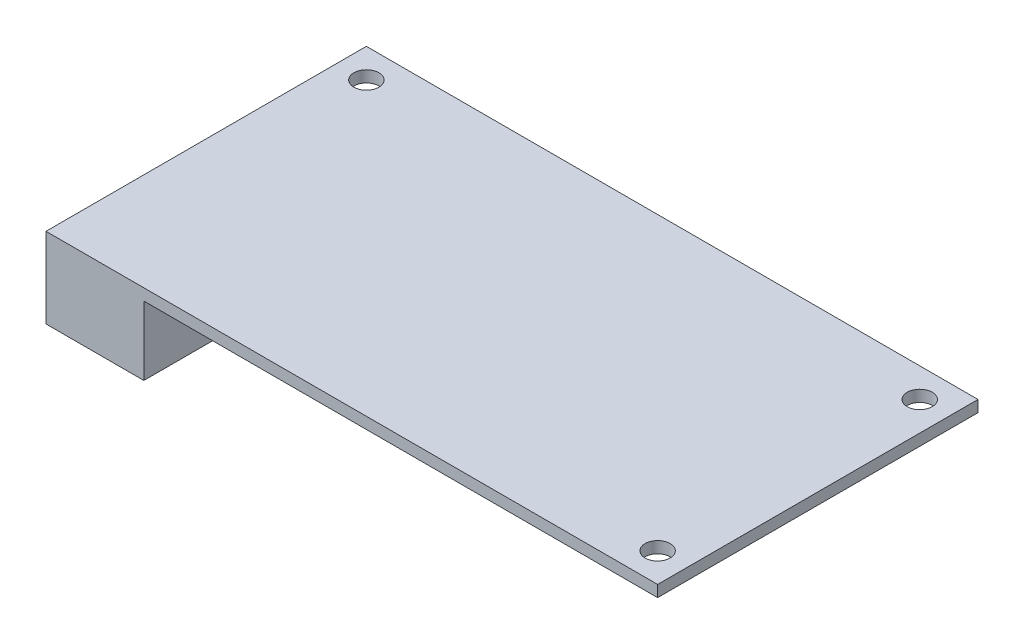
from build123d import *

# Parameters (mm, degrees)
SKETCH1_W           = 53.34
SKETCH1_H           = 27.94
SKETCH1_R           = 1.0922
BOSS_EXTRUDE1_DEPTH = 1
SKETCH2_W           = 8.533603159
SKETCH2_H           = 19.883520928
SKETCH2_W_2         = 10.243705623
SKETCH2_H_2         = 7.528700328
BOSS_EXTRUDE2_DEPTH = 7


with BuildPart() as part:
    # Sketch1 → Boss-Extrude1 (new body)
    with BuildSketch(Plane(origin=(0, 0, 0), x_dir=(1, 0, 0), z_dir=(0, 1, 0))):
        Rectangle(SKETCH1_W, SKETCH1_H)
        with Locations(Location((-24.13, 11.43, 0), (0, 0, 270))):
            Circle(SKETCH1_R, mode=Mode.SUBTRACT)
        with Locations(Location((24.13, 11.43, 0), (0, 0, 270))):
            Circle(SKETCH1_R, mode=Mode.SUBTRACT)
        with Locations(Location((24.13, -11.43, 0), (0, 0, 270))):
            Circle(SKETCH1_R, mode=Mode.SUBTRACT)
    extrude(amount=BOSS_EXTRUDE1_DEPTH)

    # Sketch2 → Boss-Extrude2 (add)
    with BuildSketch(Plane(origin=(0, 1, 0), x_dir=(1, 0, 0), z_dir=(0, 1, 0))):
        with Locations((-22.403198421, -4.028239536)):
            Rectangle(SKETCH2_W, SKETCH2_H)
        with Locations((-0.059974857, 10.205649836)):
            Rectangle(SKETCH2_W_2, SKETCH2_H_2)
    extrude(amount=-BOSS_EXTRUDE2_DEPTH)


solid = part.part
